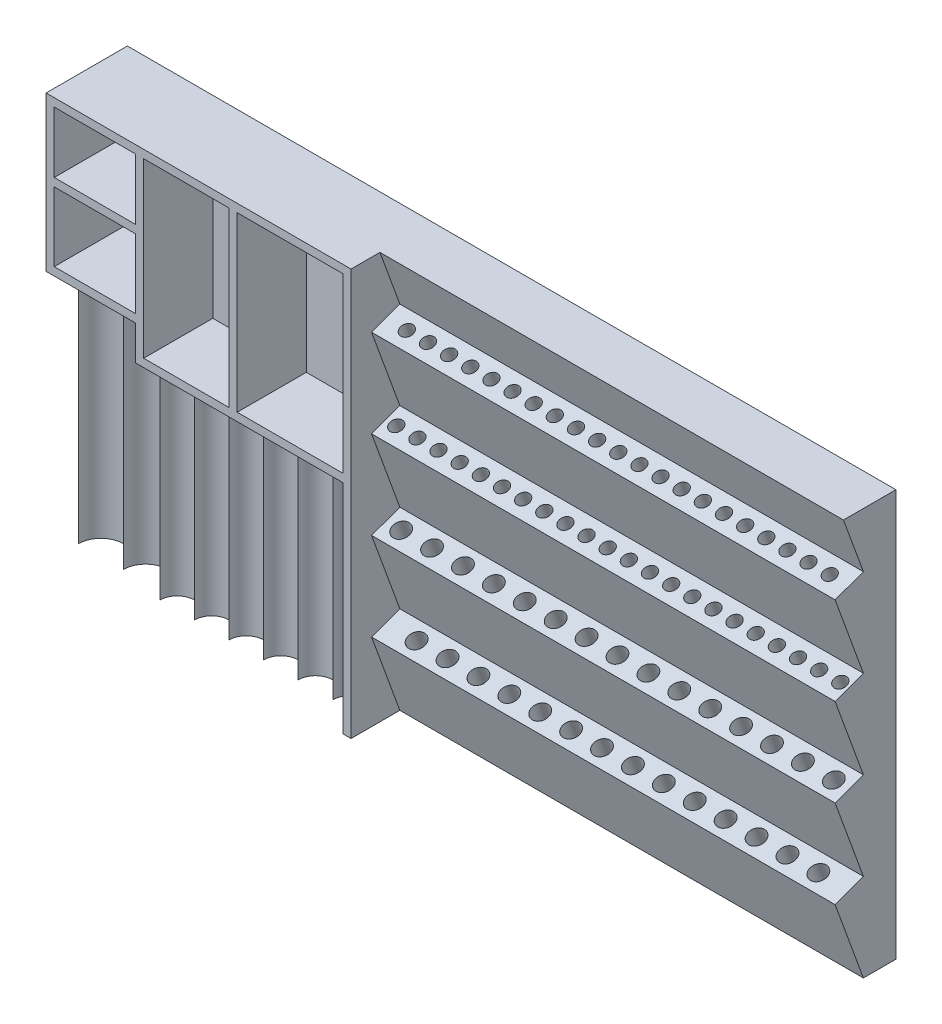
from build123d import *

# Parameters (mm, degrees)
SKETCH1_W           = 240.03
SKETCH1_H           = 127
BOSS_EXTRUDE1_DEPTH = 25.4
CUT_EXTRUDE1_DEPTH  = 78.74
CUT_EXTRUDE2_DEPTH  = 78.74
CUT_EXTRUDE3_DEPTH  = 67.945
LPATTERN1_COUNT     = 6
LPATTERN1_PITCH     = 10.795
CUT_EXTRUDE4_DEPTH  = 144.78
SKETCH6_R           = 2.6035
CUT_EXTRUDE5_DEPTH  = 25.4
LPATTERN2_COUNT     = 15
LPATTERN2_PITCH     = 9.652
SKETCH7_R           = 2.6035
CUT_EXTRUDE6_DEPTH  = 25.4
LPATTERN3_COUNT     = 14
LPATTERN3_PITCH     = 9.652
SKETCH8_R           = 1.9685
CUT_EXTRUDE7_DEPTH  = 19.05
LPATTERN4_COUNT     = 22
LPATTERN4_PITCH     = 6.604
SKETCH9_R           = 1.9685
CUT_EXTRUDE8_DEPTH  = 19.05
LPATTERN5_COUNT     = 21
LPATTERN5_PITCH     = 6.604
SKETCH10_W          = 33.02
SKETCH10_H          = 53.975
CUT_EXTRUDE9_DEPTH  = 21.59
SKETCH11_W          = 26.67
SKETCH11_H          = 53.975
CUT_EXTRUDE10_DEPTH = 21.59
SKETCH12_W          = 25.4
SKETCH12_H          = 21.59
CUT_EXTRUDE11_DEPTH = 21.59
SKETCH13_W          = 25.4
SKETCH13_H          = 19.05
CUT_EXTRUDE12_DEPTH = 21.59


with BuildPart() as part:
    # Sketch1 → Boss-Extrude1 (new body)
    with BuildSketch(Plane.XY):
        with Locations((120.015, 63.5)):
            Rectangle(SKETCH1_W, SKETCH1_H)
    extrude(amount=BOSS_EXTRUDE1_DEPTH)

    # Sketch2 → Cut-Extrude1 (cut)
    with BuildSketch(Plane.XZ):
        with BuildLine():
            Line((13.97, 15.24), (13.97, 25.4))
            Line((13.97, 25.4), (0, 25.4))
            Line((0, 25.4), (0, 15.24))
            ThreePointArc((0, 15.24), (6.985, 8.255), (13.97, 15.24))
        make_face()
    extrude(amount=-CUT_EXTRUDE1_DEPTH, mode=Mode.SUBTRACT)

    # Sketch3 → Cut-Extrude2 (cut)
    with BuildSketch(Plane.XZ):
        with BuildLine():
            Line((27.94, 15.24), (27.94, 25.4))
            Line((27.94, 25.4), (13.97, 25.4))
            Line((13.97, 25.4), (13.97, 15.24))
            ThreePointArc((13.97, 15.24), (20.955, 8.255), (27.94, 15.24))
        make_face()
    extrude(amount=-CUT_EXTRUDE2_DEPTH, mode=Mode.SUBTRACT)

    # Sketch4 → Cut-Extrude3 (cut)
    with BuildSketch(Plane.XZ):
        with BuildLine():
            Line((38.735, 17.78), (38.735, 25.4))
            Line((38.735, 25.4), (27.94, 25.4))
            Line((27.94, 25.4), (27.94, 17.78))
            ThreePointArc((27.94, 17.78), (33.3375, 12.3825), (38.735, 17.78))
        make_face()
    cut_extrude3 = extrude(amount=-CUT_EXTRUDE3_DEPTH, mode=Mode.SUBTRACT)

    # LPattern1: Cut-Extrude3 ×6
    with Locations(*[(i * LPATTERN1_PITCH, 0, 0) for i in range(1, LPATTERN1_COUNT)]):
        add(cut_extrude3, mode=Mode.SUBTRACT)

    # Sketch5 → Cut-Extrude4 (cut)
    with BuildSketch(Plane(origin=(240.03, 0, 0), x_dir=(0, 0, -1), z_dir=(1, 0, 0))):
        Polygon((-10.16, 0), (-25.4, 0), (-25.4, 127), (-16.379648929, 127), (-10.16, 109.911655011), (-18.99123125, 106.697349704), (-10.16, 82.433741258), (-18.99123125, 79.219435951), (-10.16, 54.955827505), (-18.99123125, 51.741522198), (-10.16, 27.477913753), (-18.99123125, 24.263608446), align=None)
    extrude(amount=-CUT_EXTRUDE4_DEPTH, mode=Mode.SUBTRACT)

    # Sketch6 → Cut-Extrude5 (cut)
    with BuildSketch(Plane(origin=(0, 51.792577949, 18.850956729), x_dir=(1, 0, 0), z_dir=(0, 0.9396926207859082, 0.34202014332566955))):
        with Locations(Location((100.076, 4.549722973, 0), (0, 0, 270))):
            Circle(SKETCH6_R)
    cut_extrude5 = extrude(amount=-CUT_EXTRUDE5_DEPTH, mode=Mode.SUBTRACT)

    # LPattern2: Cut-Extrude5 ×15
    with Locations(*[(i * LPATTERN2_PITCH, 0, 0) for i in range(1, LPATTERN2_COUNT)]):
        add(cut_extrude5, mode=Mode.SUBTRACT)

    # Sketch7 → Cut-Extrude6 (cut)
    with BuildSketch(Plane(origin=(0, 27.528969503, 10.019725479), x_dir=(1, 0, 0), z_dir=(0, 0.9396926207859083, 0.34202014332566905))):
        with Locations(Location((104.902, -4.848277027, 0), (0, 0, 270))):
            Circle(SKETCH7_R)
    cut_extrude6 = extrude(amount=-CUT_EXTRUDE6_DEPTH, mode=Mode.SUBTRACT)

    # LPattern3: Cut-Extrude6 ×14
    with Locations(*[(i * LPATTERN3_PITCH, 0, 0) for i in range(1, LPATTERN3_COUNT)]):
        add(cut_extrude6, mode=Mode.SUBTRACT)

    # Sketch8 → Cut-Extrude7 (cut)
    with BuildSketch(Plane(origin=(0, 76.056186394, 27.682187979), x_dir=(1, 0, 0), z_dir=(0, 0.9396926207859077, 0.3420201433256707))):
        with Locations(Location((98.552, 13.947722973, 0), (0, 0, 270))):
            Circle(SKETCH8_R)
    cut_extrude7 = extrude(amount=-CUT_EXTRUDE7_DEPTH, mode=Mode.SUBTRACT)

    # LPattern4: Cut-Extrude7 ×22
    with Locations(*[(i * LPATTERN4_PITCH, 0, 0) for i in range(1, LPATTERN4_COUNT)]):
        add(cut_extrude7, mode=Mode.SUBTRACT)

    # Sketch9 → Cut-Extrude8 (cut)
    with BuildSketch(Plane(origin=(0, 100.31979484, 36.51341923), x_dir=(1, 0, 0), z_dir=(0, 0.9396926207859077, 0.34202014332567077))):
        with Locations(Location((101.854, 23.345722973, 0), (0, 0, 270))):
            Circle(SKETCH9_R)
    cut_extrude8 = extrude(amount=-CUT_EXTRUDE8_DEPTH, mode=Mode.SUBTRACT)

    # LPattern5: Cut-Extrude8 ×21
    with Locations(*[(i * LPATTERN5_PITCH, 0, 0) for i in range(1, LPATTERN5_COUNT)]):
        add(cut_extrude8, mode=Mode.SUBTRACT)

    # Sketch10 → Cut-Extrude9 (cut)
    with BuildSketch(Plane.XY.offset(25.4)):
        with Locations((76.2, 97.4725)):
            Rectangle(SKETCH10_W, SKETCH10_H)
    extrude(amount=-CUT_EXTRUDE9_DEPTH, mode=Mode.SUBTRACT)

    # Sketch11 → Cut-Extrude10 (cut)
    with BuildSketch(Plane.XY.offset(25.4)):
        with Locations((43.815, 97.4725)):
            Rectangle(SKETCH11_W, SKETCH11_H)
    extrude(amount=-CUT_EXTRUDE10_DEPTH, mode=Mode.SUBTRACT)

    # Sketch12 → Cut-Extrude11 (cut)
    with BuildSketch(Plane.XY.offset(25.4)):
        with Locations((15.24, 92.075)):
            Rectangle(SKETCH12_W, SKETCH12_H)
    extrude(amount=-CUT_EXTRUDE11_DEPTH, mode=Mode.SUBTRACT)

    # Sketch13 → Cut-Extrude12 (cut)
    with BuildSketch(Plane.XY.offset(25.4)):
        with Locations((15.24, 114.935)):
            Rectangle(SKETCH13_W, SKETCH13_H)
    extrude(amount=-CUT_EXTRUDE12_DEPTH, mode=Mode.SUBTRACT)


solid = part.part
